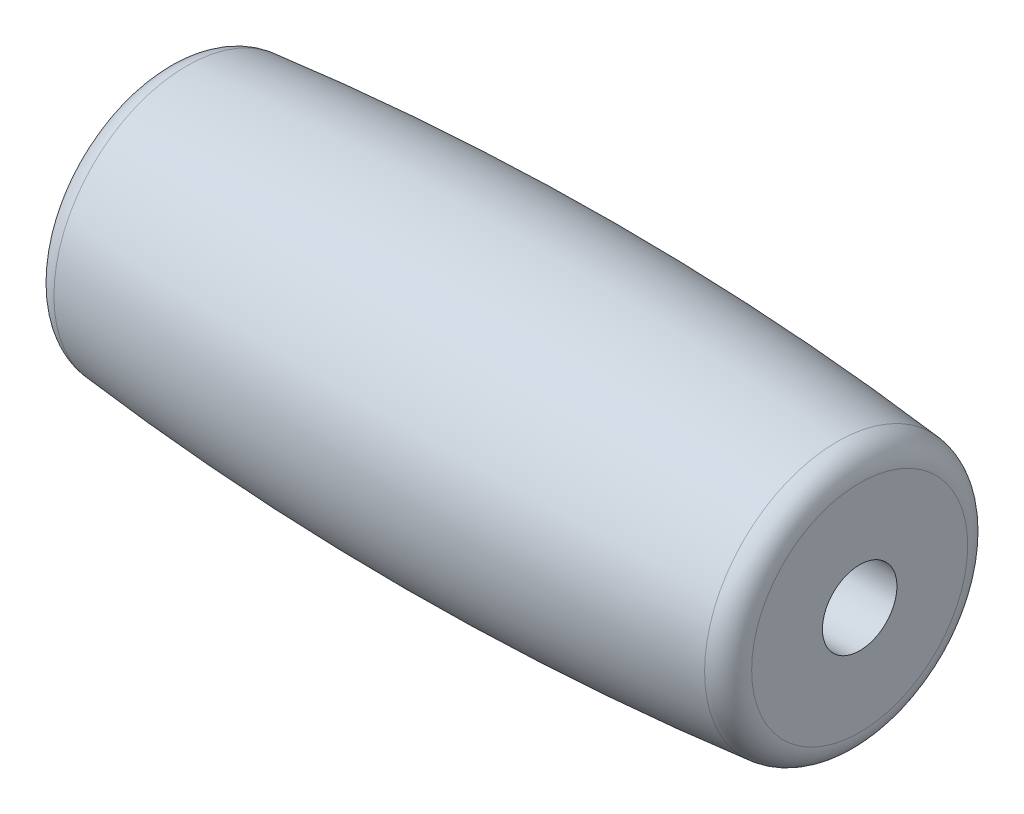
from build123d import *


with BuildPart() as part:
    # Sketch1 → Revolve1 (revolve)
    with BuildSketch(Plane.XY, mode=Mode.PRIVATE) as revolve1_sk:
        with BuildLine():
            Line((-14, 1.5), (14, 1.5))
            Line((14, 1.5), (14, 4.35))
            ThreePointArc((14, 4.35), (13.741554051, 5.020893128), (13.099804821, 5.345007034))
            ThreePointArc((13.099804821, 5.345007034), (-9.0366e-05, 5.999999995), (-13.099913761, 5.343572766))
            ThreePointArc((-13.099913761, 5.343572766), (-13.741590777, 5.019429197), (-14, 4.348576665))
            Line((-14, 4.348576665), (-14, 1.5))
        make_face()
    revolve(revolve1_sk.sketch.rotate(Axis((0, 0, 0), (1, 0, 0)), 90), axis=Axis((0, 0, 0), (1, 0, 0)))


solid = part.part
